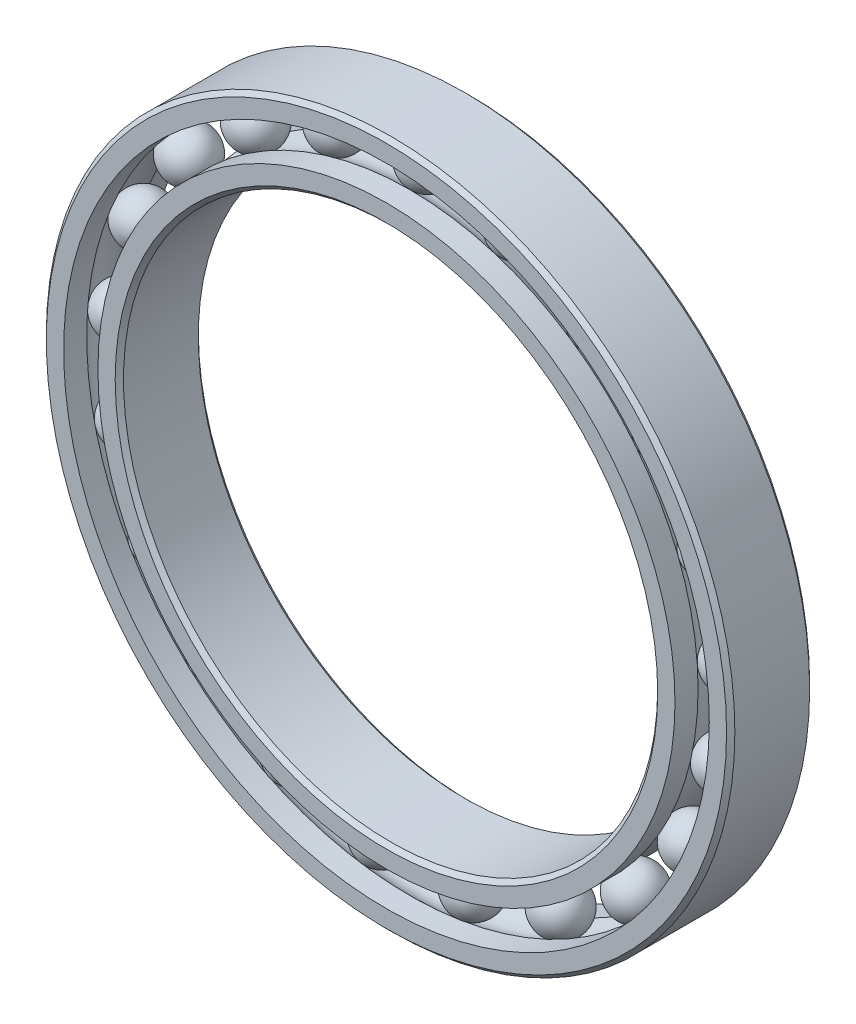
from build123d import *

# Parameters (mm, degrees)
CIRPATTERN1_COUNT = 21


with BuildPart() as part:
    # Sketch5 → Revolve1 (revolve)
    with BuildSketch(Plane(origin=(0, 0, 0), x_dir=(0, 0, -1), z_dir=(1, 0, 0))):
        with BuildLine():
            Line((3.15, 29), (-3.15, 29))
            Line((-3.15, 29), (-3.5, 28.65))
            Line((-3.5, 28.65), (-3.5, 27.194444444))
            Line((-3.5, 27.194444444), (-1.555555556, 27.194444444))
            ThreePointArc((-1.555555556, 27.194444444), (0, 27.872774797), (1.555555556, 27.194444444))
            Line((1.555555556, 27.194444444), (3.5, 27.194444444))
            Line((3.5, 27.194444444), (3.5, 28.65))
            Line((3.5, 28.65), (3.15, 29))
        make_face()
    revolve(axis=Axis((0, 0, 3.5), (0, 0, -1)))


with BuildPart() as body_2:
    # Sketch3 → Revolve3 (revolve)
    with BuildSketch(Plane(origin=(0, 0, 0), x_dir=(0, 0, -1), z_dir=(1, 0, 0))):
        with BuildLine():
            Line((-3.5, 24.305555556), (-1.555555556, 24.305555556))
            ThreePointArc((-1.555555556, 24.305555556), (0, 23.627225203), (1.555555556, 24.305555556))
            Line((1.555555556, 24.305555556), (3.5, 24.305555556))
            Line((3.5, 24.305555556), (3.5, 22.85))
            Line((3.5, 22.85), (3.15, 22.5))
            Line((3.15, 22.5), (-3.15, 22.5))
            Line((-3.15, 22.5), (-3.5, 22.85))
            Line((-3.5, 22.85), (-3.5, 24.305555556))
        make_face()
    revolve(axis=Axis((0, 0, 3.5), (0, 0, -1)))


with BuildPart() as body_3:
    # Sketch4 → Revolve4 (revolve)
    with BuildSketch(Plane(origin=(0, 0, 0), x_dir=(0, 0, -1), z_dir=(1, 0, 0))):
        with BuildLine():
            Line((-2.122774797, 25.75), (2.122774797, 25.75))
            ThreePointArc((2.122774797, 25.75), (0, 27.872774797), (-2.122774797, 25.75))
        make_face()
    revolve(axis=Axis((0, 25.75, 2.122774797), (0, 0, -1)))


with BuildPart() as cirpattern1_1:
    # CirPattern1: pattern copy
    add(body_3.part.rotate(Axis((0, 0, 0), (0, 0, 1)), 1 * 360 / CIRPATTERN1_COUNT))


with BuildPart() as cirpattern1_2:
    # CirPattern1: pattern copy
    add(body_3.part.rotate(Axis((0, 0, 0), (0, 0, 1)), 2 * 360 / CIRPATTERN1_COUNT))


with BuildPart() as cirpattern1_3:
    # CirPattern1: pattern copy
    add(body_3.part.rotate(Axis((0, 0, 0), (0, 0, 1)), 3 * 360 / CIRPATTERN1_COUNT))


with BuildPart() as cirpattern1_4:
    # CirPattern1: pattern copy
    add(body_3.part.rotate(Axis((0, 0, 0), (0, 0, 1)), 4 * 360 / CIRPATTERN1_COUNT))


with BuildPart() as cirpattern1_5:
    # CirPattern1: pattern copy
    add(body_3.part.rotate(Axis((0, 0, 0), (0, 0, 1)), 5 * 360 / CIRPATTERN1_COUNT))


with BuildPart() as cirpattern1_6:
    # CirPattern1: pattern copy
    add(body_3.part.rotate(Axis((0, 0, 0), (0, 0, 1)), 6 * 360 / CIRPATTERN1_COUNT))


with BuildPart() as cirpattern1_7:
    # CirPattern1: pattern copy
    add(body_3.part.rotate(Axis((0, 0, 0), (0, 0, 1)), 7 * 360 / CIRPATTERN1_COUNT))


with BuildPart() as cirpattern1_8:
    # CirPattern1: pattern copy
    add(body_3.part.rotate(Axis((0, 0, 0), (0, 0, 1)), 8 * 360 / CIRPATTERN1_COUNT))


with BuildPart() as cirpattern1_9:
    # CirPattern1: pattern copy
    add(body_3.part.rotate(Axis((0, 0, 0), (0, 0, 1)), 9 * 360 / CIRPATTERN1_COUNT))


with BuildPart() as cirpattern1_10:
    # CirPattern1: pattern copy
    add(body_3.part.rotate(Axis((0, 0, 0), (0, 0, 1)), 10 * 360 / CIRPATTERN1_COUNT))


with BuildPart() as cirpattern1_11:
    # CirPattern1: pattern copy
    add(body_3.part.rotate(Axis((0, 0, 0), (0, 0, 1)), 11 * 360 / CIRPATTERN1_COUNT))


with BuildPart() as cirpattern1_12:
    # CirPattern1: pattern copy
    add(body_3.part.rotate(Axis((0, 0, 0), (0, 0, 1)), 12 * 360 / CIRPATTERN1_COUNT))


with BuildPart() as cirpattern1_13:
    # CirPattern1: pattern copy
    add(body_3.part.rotate(Axis((0, 0, 0), (0, 0, 1)), 13 * 360 / CIRPATTERN1_COUNT))


with BuildPart() as cirpattern1_14:
    # CirPattern1: pattern copy
    add(body_3.part.rotate(Axis((0, 0, 0), (0, 0, 1)), 14 * 360 / CIRPATTERN1_COUNT))


with BuildPart() as cirpattern1_15:
    # CirPattern1: pattern copy
    add(body_3.part.rotate(Axis((0, 0, 0), (0, 0, 1)), 15 * 360 / CIRPATTERN1_COUNT))


with BuildPart() as cirpattern1_16:
    # CirPattern1: pattern copy
    add(body_3.part.rotate(Axis((0, 0, 0), (0, 0, 1)), 16 * 360 / CIRPATTERN1_COUNT))


with BuildPart() as cirpattern1_17:
    # CirPattern1: pattern copy
    add(body_3.part.rotate(Axis((0, 0, 0), (0, 0, 1)), 17 * 360 / CIRPATTERN1_COUNT))


with BuildPart() as cirpattern1_18:
    # CirPattern1: pattern copy
    add(body_3.part.rotate(Axis((0, 0, 0), (0, 0, 1)), 18 * 360 / CIRPATTERN1_COUNT))


with BuildPart() as cirpattern1_19:
    # CirPattern1: pattern copy
    add(body_3.part.rotate(Axis((0, 0, 0), (0, 0, 1)), 19 * 360 / CIRPATTERN1_COUNT))


with BuildPart() as cirpattern1_20:
    # CirPattern1: pattern copy
    add(body_3.part.rotate(Axis((0, 0, 0), (0, 0, 1)), 20 * 360 / CIRPATTERN1_COUNT))


solid = Compound([part.part, body_2.part, body_3.part, cirpattern1_1.part, cirpattern1_2.part, cirpattern1_3.part, cirpattern1_4.part, cirpattern1_5.part, cirpattern1_6.part, cirpattern1_7.part, cirpattern1_8.part, cirpattern1_9.part, cirpattern1_10.part, cirpattern1_11.part, cirpattern1_12.part, cirpattern1_13.part, cirpattern1_14.part, cirpattern1_15.part, cirpattern1_16.part, cirpattern1_17.part, cirpattern1_18.part, cirpattern1_19.part, cirpattern1_20.part])
